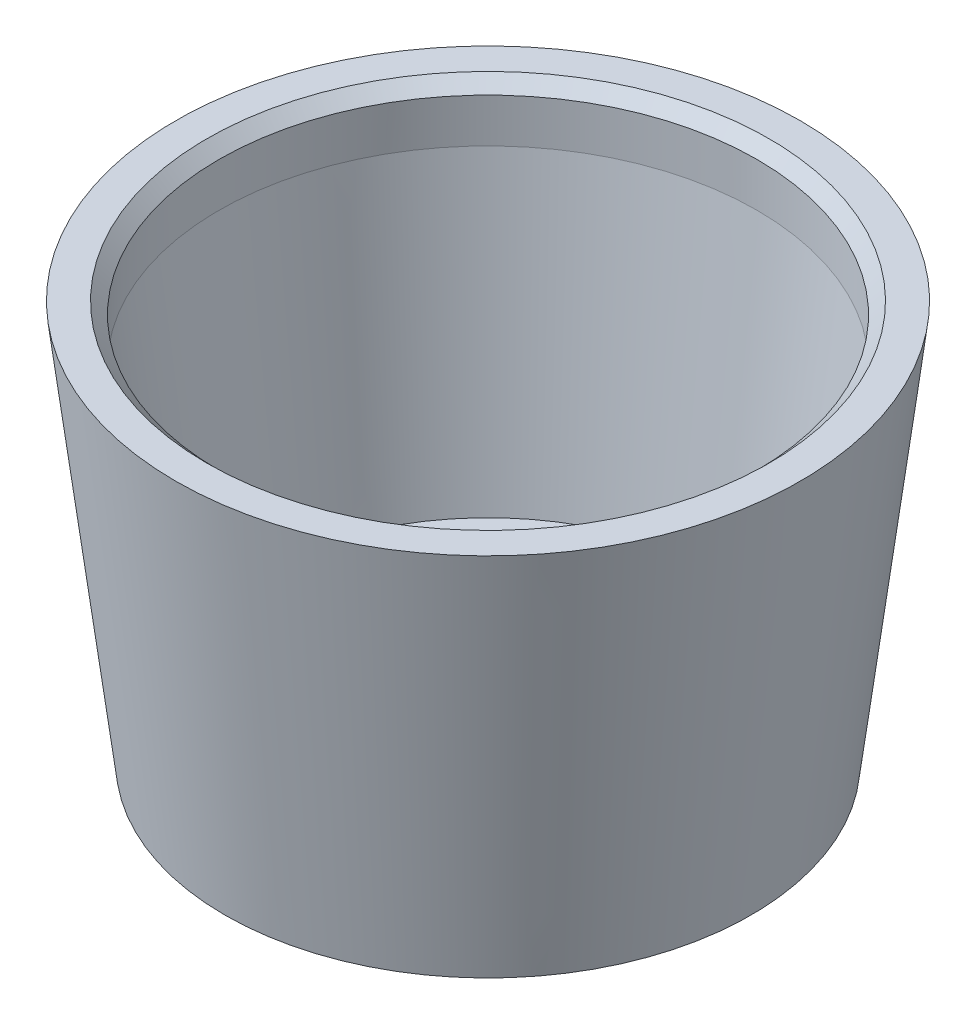
from build123d import *

# Parameters (mm, degrees)
CHAMFER1_SIZE = 1.905


with BuildPart() as part:
    # Sketch1 → Revolve1 (revolve)
    with BuildSketch(Plane(origin=(0, 0, 0), x_dir=(0, 0, -1), z_dir=(1, 0, 0))):
        Polygon((41.733180383, 0), (49.53, 63.5), (42.680526601, 63.5), (42.680526601, 54.61), (36.910880084, 7.62), (0, 7.62), (0, 0.635), (36.018180383, 0.635), (36.653180383, 0), align=None)
    revolve(axis=Axis((0, 0, 0), (0, 1, 0)))

    # Chamfer1
    chamfer1_edges = [part.edges().sort_by_distance(p)[0] for p in [
        (0, 63.5, 42.680526601),
    ]]
    chamfer(chamfer1_edges, length=CHAMFER1_SIZE)


solid = part.part
